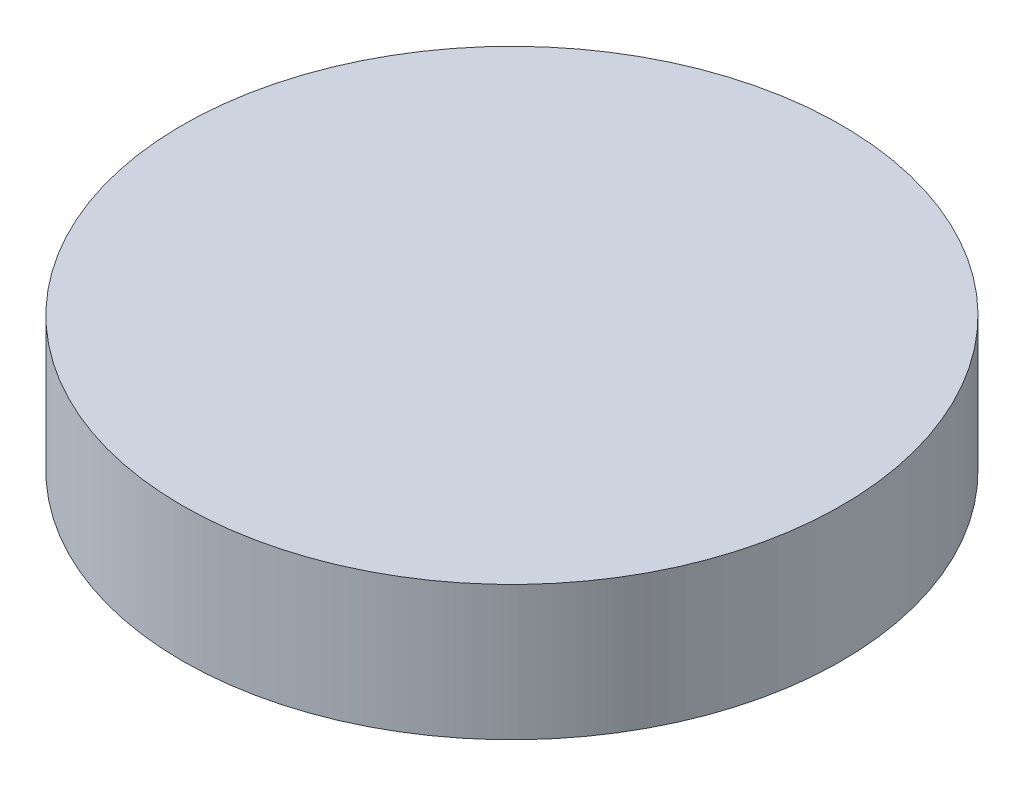
from build123d import *

# Parameters (mm, degrees)
SKETCH1_R           = 12.25
BOSS_EXTRUDE1_DEPTH = 5


with BuildPart() as part:
    # Sketch1 → Boss-Extrude1 (new body)
    with BuildSketch(Plane(origin=(0, 0, 0), x_dir=(1, 0, 0), z_dir=(0, 1, 0))):
        with Locations(Location((0, 0, 0), (0, 0, 270))):
            Circle(SKETCH1_R)
    extrude(amount=BOSS_EXTRUDE1_DEPTH)


solid = part.part
